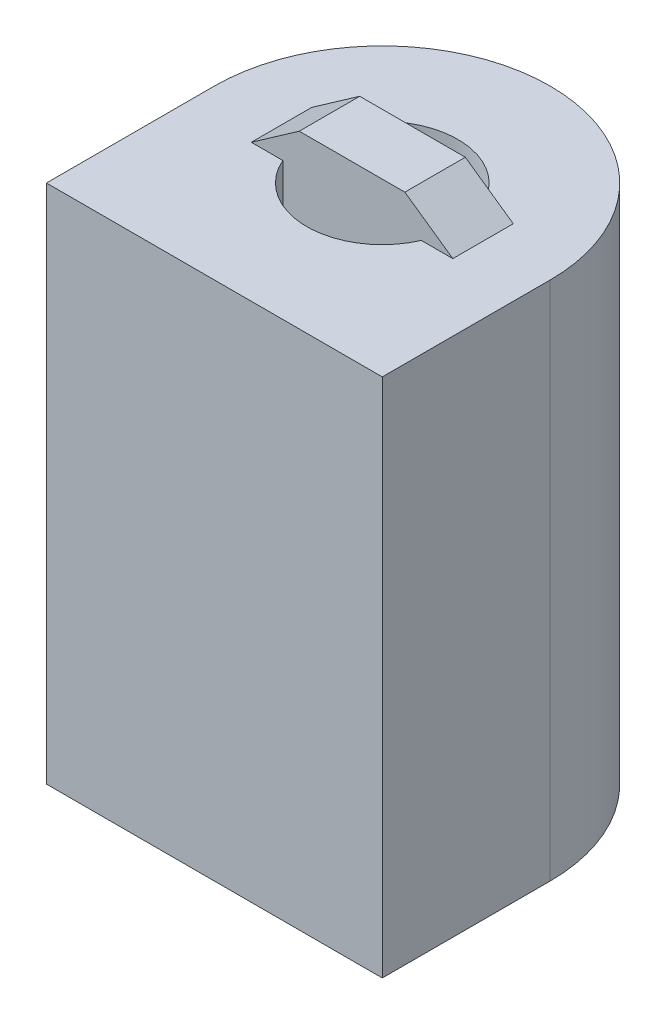
from build123d import *

# Parameters (mm, degrees)
SKETCH1_R           = 12.7
BOSS_EXTRUDE1_DEPTH = 38.1
SKETCH2_R           = 5.715
CUT_EXTRUDE1_DEPTH  = 43.121134838
SKETCH3_R           = 9.3345
CUT_EXTRUDE2_DEPTH  = 12.7
SKETCH4_R           = 12.7
SKETCH4_R_2         = 5.715
BOSS_EXTRUDE2_DEPTH = 1.27
SKETCH5_W           = 11.43
SKETCH5_H           = 4.572
BOSS_EXTRUDE3_DEPTH = 6.35
BOSS_EXTRUDE4_DEPTH = 4.572
BOSS_EXTRUDE5_START = -39.37
BOSS_EXTRUDE5_DEPTH = 39.37


with BuildPart() as part:
    # Sketch1 → Boss-Extrude1 (new body)
    with BuildSketch(Plane(origin=(0, 0, 0), x_dir=(1, 0, 0), z_dir=(0, 1, 0))):
        with Locations(Location((0, 0, 0), (0, 0, 90))):
            Circle(SKETCH1_R)
    extrude(amount=BOSS_EXTRUDE1_DEPTH)

    # Sketch2 → Cut-Extrude1 (cut, through all)
    with BuildSketch(Plane(origin=(0, 38.1, 0), x_dir=(1, 0, 0), z_dir=(0, 1, 0))):
        with Locations(Location((0, 0, 0), (0, 0, 270))):
            Circle(SKETCH2_R)
    extrude(amount=-CUT_EXTRUDE1_DEPTH, mode=Mode.SUBTRACT)

    # Sketch3 → Cut-Extrude2 (cut)
    with BuildSketch(Plane.XZ):
        with Locations(Location((0, 0, 0), (0, 0, 270))):
            Circle(SKETCH3_R)
    extrude(amount=-CUT_EXTRUDE2_DEPTH, mode=Mode.SUBTRACT)

    # Sketch4 → Boss-Extrude2 (add)
    with BuildSketch(Plane(origin=(0, 38.1, 0), x_dir=(1, 0, 0), z_dir=(0, 1, 0))):
        with Locations(Location((0, 0, 0), (0, 0, 90))):
            Circle(SKETCH4_R)
        with Locations(Location((0, 0, 0), (0, 0, 270))):
            Circle(SKETCH4_R_2, mode=Mode.SUBTRACT)
    extrude(amount=BOSS_EXTRUDE2_DEPTH)

    # Sketch5 → Boss-Extrude3 (add)
    with BuildSketch(Plane(origin=(0, 39.37, 0), x_dir=(1, 0, 0), z_dir=(0, 1, 0))):
        Rectangle(SKETCH5_W, SKETCH5_H)
    extrude(amount=-BOSS_EXTRUDE3_DEPTH)

    # Sketch6 → Boss-Extrude4 (add)
    with BuildSketch(Plane(origin=(0, 0, -2.286), x_dir=(-1, 0, 0), z_dir=(0, 0, -1))):
        Polygon((7.62, 39.37), (-7.62, 39.37), (-3.992504063, 41.91), (3.992504063, 41.91), align=None)
    extrude(amount=-BOSS_EXTRUDE4_DEPTH)

    # Sketch7 → Boss-Extrude5 (add)
    with BuildSketch(Plane(origin=(0, 39.37, 0), x_dir=(1, 0, 0), z_dir=(0, 1, 0)).offset(BOSS_EXTRUDE5_START)):
        with BuildLine():
            ThreePointArc((12.7, 0), (8.980256115, -8.980256127), (-1.7e-08, -12.7))
            Line((-1.7e-08, -12.7), (12.7, -12.7))
            Line((12.7, -12.7), (12.7, 0))
        make_face()
        with BuildLine():
            ThreePointArc((-1.7e-08, -12.7), (-8.980256127, -8.980256115), (-12.7, 0))
            Line((-12.7, 0), (-12.7, -12.7))
            Line((-12.7, -12.7), (-1.7e-08, -12.7))
        make_face()
    extrude(amount=BOSS_EXTRUDE5_DEPTH)


solid = part.part
